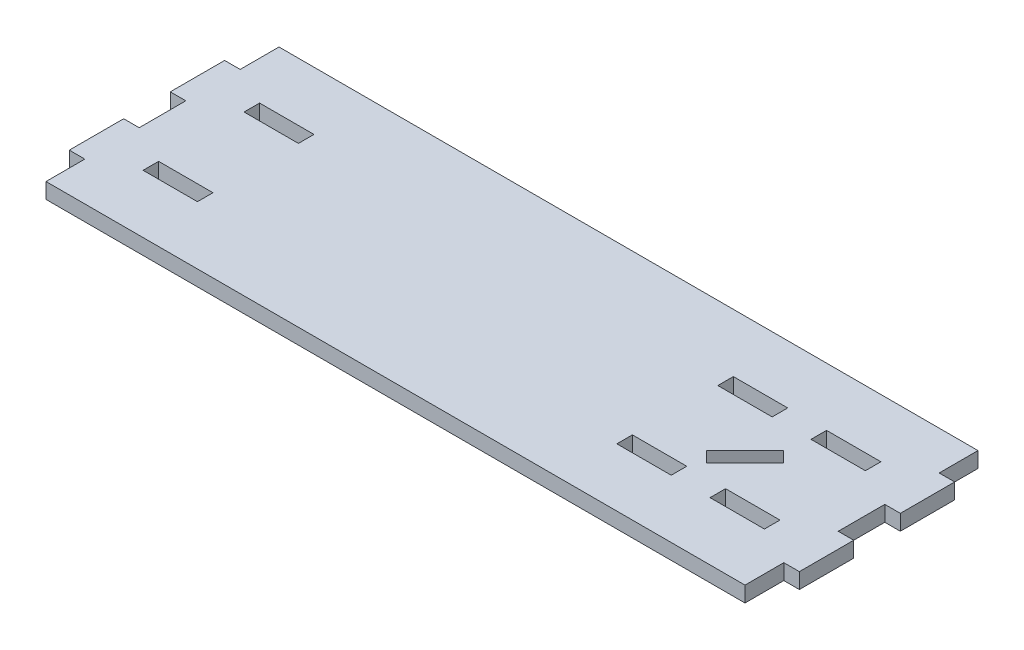
from build123d import *

# Parameters (mm, degrees)
SKETCH1_W           = 2
SKETCH1_H           = 7
SKETCH1_W_2         = 7
SKETCH1_H_2         = 2
BOSS_EXTRUDE1_DEPTH = 2


with BuildPart() as part:
    # Sketch1 → Boss-Extrude1 (new body)
    # profile 1 of 6: a face of its own
    with BuildSketch(Plane(origin=(0, 0, 0), x_dir=(1, 0, 0), z_dir=(0, 1, 0))):
        with Locations((-24.050101389, 5.323848353)):
            Rectangle(SKETCH1_W, SKETCH1_H)
    # profile 2 of 6: a face of its own
    with BuildSketch(Plane(origin=(0, 0, 0), x_dir=(1, 0, 0), z_dir=(0, 1, 0))):
        with Locations((-24.050101389, -7.676151647)):
            Rectangle(SKETCH1_W, SKETCH1_H)
    # profile 3 of 6: a face of its own
    with BuildSketch(Plane(origin=(0, 0, 0), x_dir=(1, 0, 0), z_dir=(0, 1, 0))):
        Polygon((66.949898611, 13.823848353), (-23.050101389, 13.823848353), (-23.050101389, 8.823848353), (-23.050101389, 1.823848353), (-23.050101389, -4.176151647), (-23.050101389, -11.176151647), (-23.050101389, -16.176151647), (66.949898611, -16.176151647), (66.949898611, -11.176151647), (66.949898611, -4.176151647), (66.949898611, 1.823848353), (66.949898611, 8.823848353), align=None)
        with Locations((-14.550101389, -7.676151647)):
            Rectangle(SKETCH1_W_2, SKETCH1_H_2, mode=Mode.SUBTRACT)
        with Locations((46.449898611, -7.676151647)):
            Rectangle(SKETCH1_W_2, SKETCH1_H_2, mode=Mode.SUBTRACT)
        with Locations((58.449898611, -7.676151647)):
            Rectangle(SKETCH1_W_2, SKETCH1_H_2, mode=Mode.SUBTRACT)
        Polygon((54.425685048, 1.299905334), (55.839898611, -0.114308229), (50.890151142, -5.064055697), (49.47593758, -3.649842135), align=None, mode=Mode.SUBTRACT)
        with Locations((-14.550101389, 5.323848353)):
            Rectangle(SKETCH1_W_2, SKETCH1_H_2, mode=Mode.SUBTRACT)
        with Locations((46.449898611, 5.323848353)):
            Rectangle(SKETCH1_W_2, SKETCH1_H_2, mode=Mode.SUBTRACT)
        with Locations((58.449898611, 5.323848353)):
            Rectangle(SKETCH1_W_2, SKETCH1_H_2, mode=Mode.SUBTRACT)
    # profile 4 of 6: a face of its own
    with BuildSketch(Plane(origin=(0, 0, 0), x_dir=(1, 0, 0), z_dir=(0, 1, 0))):
        with Locations((67.949898611, 5.323848353)):
            Rectangle(SKETCH1_W, SKETCH1_H)
    # profile 5 of 6: a face of its own
    with BuildSketch(Plane(origin=(0, 0, 0), x_dir=(1, 0, 0), z_dir=(0, 1, 0))):
        with Locations((67.949898611, -7.676151647)):
            Rectangle(SKETCH1_W, SKETCH1_H)
    # profile 6 of 6: a face of its own
    with BuildSketch(Plane(origin=(0, 0, 0), x_dir=(1, 0, 0), z_dir=(0, 1, 0))):
        Polygon((66.949898611, 13.823848353), (-23.050101389, 13.823848353), (-23.050101389, 8.823848353), (-23.050101389, 1.823848353), (-23.050101389, -4.176151647), (-23.050101389, -11.176151647), (-23.050101389, -16.176151647), (66.949898611, -16.176151647), (66.949898611, -11.176151647), (66.949898611, -4.176151647), (66.949898611, 1.823848353), (66.949898611, 8.823848353), align=None)
        with Locations((-14.550101389, -7.676151647)):
            Rectangle(SKETCH1_W_2, SKETCH1_H_2, mode=Mode.SUBTRACT)
        with Locations((46.449898611, -7.676151647)):
            Rectangle(SKETCH1_W_2, SKETCH1_H_2, mode=Mode.SUBTRACT)
        with Locations((58.449898611, -7.676151647)):
            Rectangle(SKETCH1_W_2, SKETCH1_H_2, mode=Mode.SUBTRACT)
        Polygon((54.425685048, 1.299905334), (55.839898611, -0.114308229), (50.890151142, -5.064055697), (49.47593758, -3.649842135), align=None, mode=Mode.SUBTRACT)
        with Locations((-14.550101389, 5.323848353)):
            Rectangle(SKETCH1_W_2, SKETCH1_H_2, mode=Mode.SUBTRACT)
        with Locations((46.449898611, 5.323848353)):
            Rectangle(SKETCH1_W_2, SKETCH1_H_2, mode=Mode.SUBTRACT)
        with Locations((58.449898611, 5.323848353)):
            Rectangle(SKETCH1_W_2, SKETCH1_H_2, mode=Mode.SUBTRACT)
    extrude(amount=BOSS_EXTRUDE1_DEPTH)


solid = part.part
